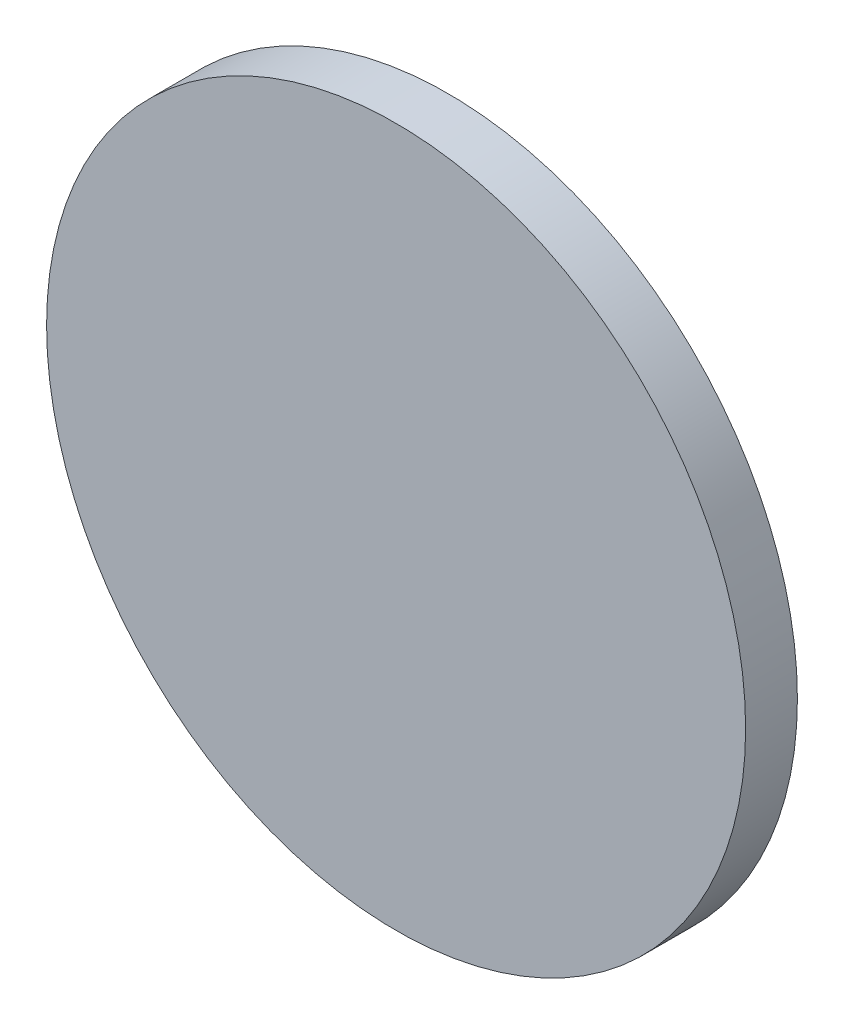
from build123d import *

# Parameters (mm, degrees)
SKETCH1_R           = 5.4
BOSS_EXTRUDE1_DEPTH = 0.8


with BuildPart() as part:
    # Sketch1 → Boss-Extrude1 (new body)
    with BuildSketch(Plane.XY):
        Circle(SKETCH1_R)
    extrude(amount=-BOSS_EXTRUDE1_DEPTH)


solid = part.part
